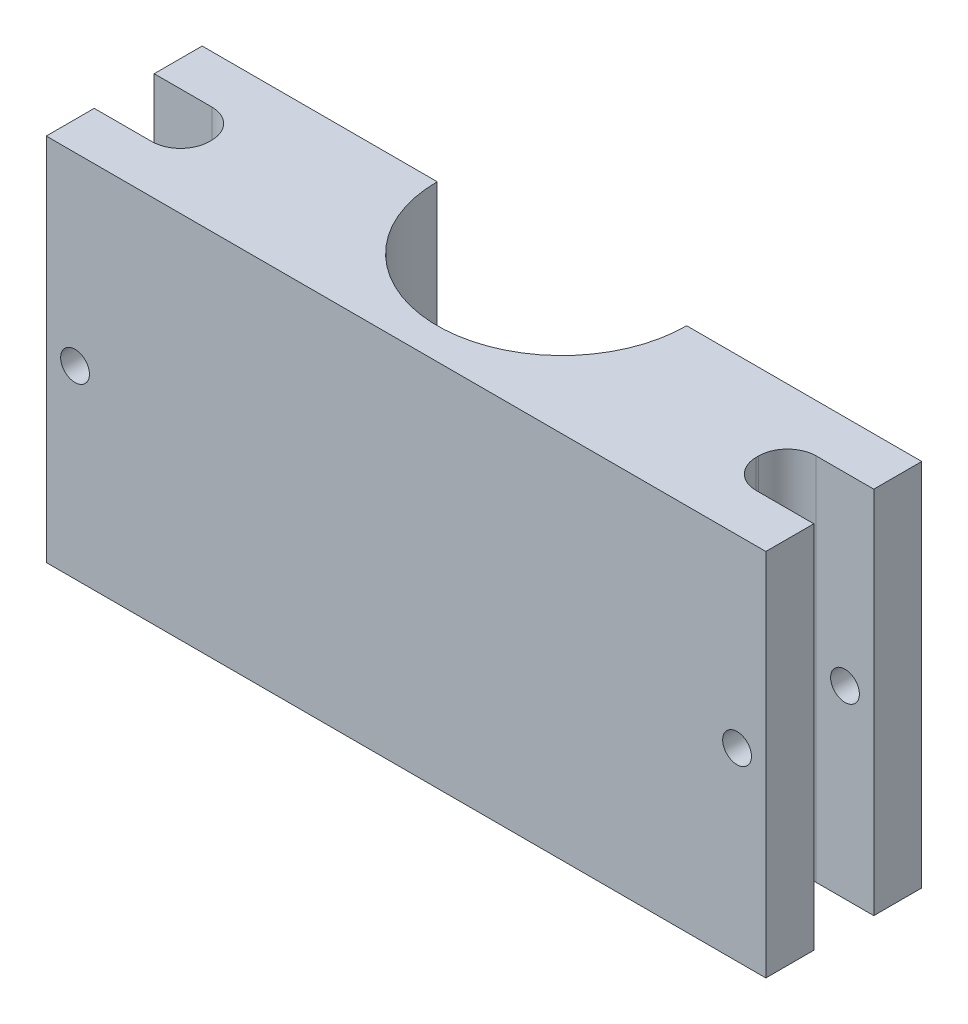
from build123d import *

# Parameters (mm, degrees)
BOSS_EXTRUDE1_DEPTH      = 38.5
BOSS_EXTRUDE1_DEPTH_BACK = 38.5
SKETCH5_R                = 3
CUT_EXTRUDE1_DEPTH       = 91.352089074


with BuildPart() as part:
    # Sketch1 → Boss-Extrude1 (new, two sides: drawn at the far end of the back side and taken through both)
    with BuildSketch(Plane(origin=(0, 0, 0), x_dir=(1, 0, 0), z_dir=(0, 1, 0)).offset(-BOSS_EXTRUDE1_DEPTH_BACK)):
        with BuildLine():
            Line((-26, 0), (-75, 0))
            Line((-75, 0), (-75, -10))
            Line((-75, -10), (-63, -10))
            ThreePointArc((-63, -10), (-58.757359313, -11.757359313), (-57, -16))
            Line((-57, -16), (-57, -16.5))
            ThreePointArc((-57, -16.5), (-58.757359313, -20.742640687), (-63, -22.5))
            Line((-63, -22.5), (-75, -22.5))
            Line((-75, -22.5), (-75, -32.5))
            Line((-75, -32.5), (75, -32.5))
            Line((75, -32.5), (75, -22.5))
            Line((75, -22.5), (63, -22.5))
            ThreePointArc((63, -22.5), (58.757359313, -20.742640687), (57, -16.5))
            Line((57, -16.5), (57, -16))
            ThreePointArc((57, -16), (58.757359313, -11.757359313), (63, -10))
            Line((63, -10), (75, -10))
            Line((75, -10), (75, 0))
            Line((75, 0), (26, 0))
            ThreePointArc((26, 0), (0, -26), (-26, 0))
        make_face()
    extrude(amount=BOSS_EXTRUDE1_DEPTH + BOSS_EXTRUDE1_DEPTH_BACK)

    # Sketch5 → Cut-Extrude1 (cut, through all)
    with BuildSketch(Plane.XY.offset(32.5)):
        with Locations((-69, 0)):
            Circle(SKETCH5_R)
        with Locations((69, 0)):
            Circle(SKETCH5_R)
    extrude(amount=-CUT_EXTRUDE1_DEPTH, mode=Mode.SUBTRACT)


solid = part.part
